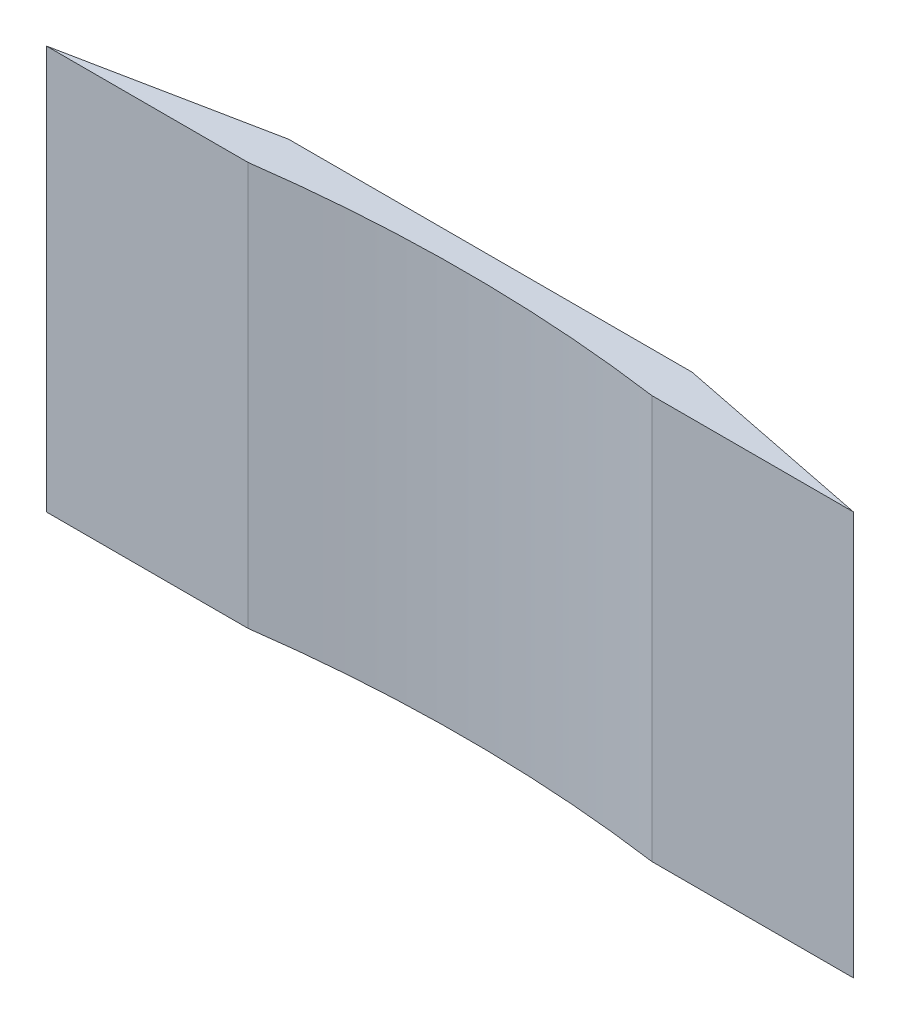
from build123d import *

# Parameters (mm, degrees)
DODANIE_WYCI_GNI_CIE1_DEPTH = 200


with BuildPart() as part:
    # Szkic1 → Dodanie-wyciągnięcie1 (new body)
    with BuildSketch(Plane(origin=(0, 0, 0), x_dir=(1, 0, 0), z_dir=(0, 1, 0))):
        with BuildLine():
            Line((-153.835021708, -33.285094067), (-53.835021708, -33.285094067))
            ThreePointArc((-53.835021708, -33.285094067), (46.164978292, -26.390366158), (146.164978292, -33.285094067))
            Line((146.164978292, -33.285094067), (246.164978292, -33.285094067))
            Line((246.164978292, -33.285094067), (146.164978292, -13.285094067))
            Line((146.164978292, -13.285094067), (-53.835021708, -13.285094067))
            Line((-53.835021708, -13.285094067), (-153.835021708, -33.285094067))
        make_face()
    extrude(amount=DODANIE_WYCI_GNI_CIE1_DEPTH)


solid = part.part
